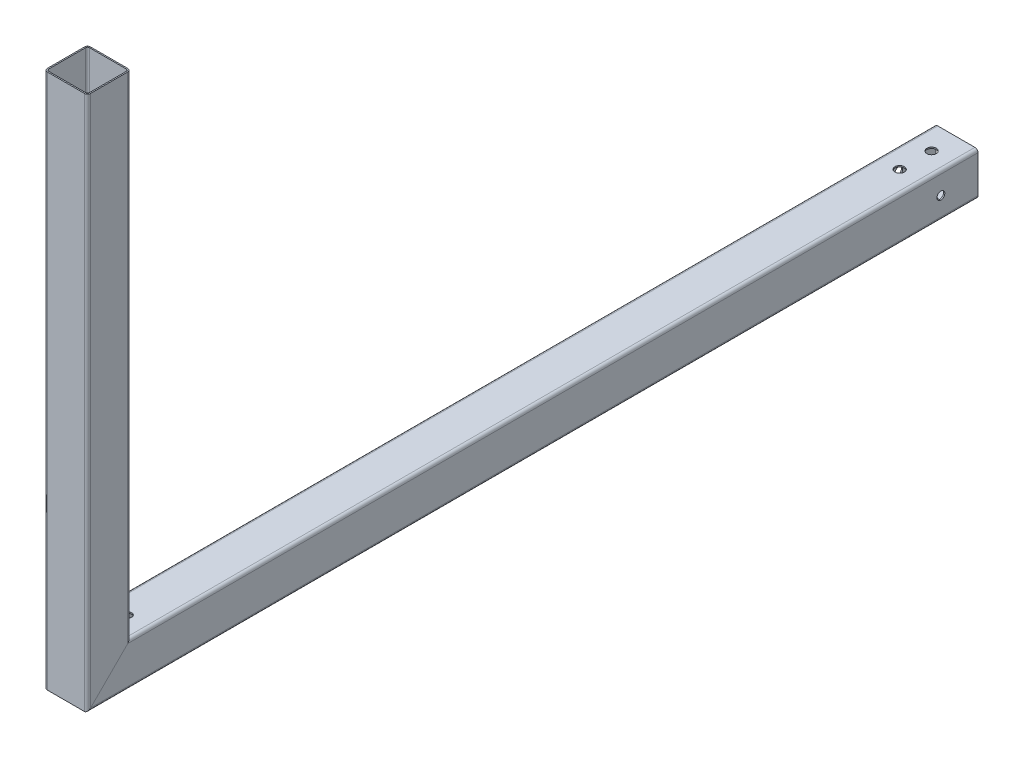
from build123d import *

# Parameters (mm, degrees)
TUBO_CUADRADO_3_X_3_X_0_25_1_DEPTH        = 880.497474683
TUBO_CUADRADO_3_X_3_X_0_25_1_2_DEPTH      = 1403.97
TUBO_CUADRADO_3_X_3_X_0_25_1_2_DEPTH_BACK = 50.497474683
CROQUIS3_R                                = 7.610855116
CROQUIS3_R_2                              = 6.35
CORTAR_EXTRUIR1_DEPTH                     = 1085.618315457
CROQUIS4_R                                = 6.35
CORTAR_EXTRUIR2_DEPTH                     = 867.341093464


with BuildPart() as part:
    # Sketch1 on segment 1 (carried to segment 1) → Tubo cuadrado 3 X 3 X 0.25(1) (new body)
    with BuildSketch(Plane(origin=(0, 415, 701.985), x_dir=(0, 0, -1), z_dir=(0, -1, 0))):
        with BuildLine():
            Line((-30, -35), (30, -35))
            ThreePointArc((30, -35), (33.535533906, -33.535533906), (35, -30))
            Line((35, -30), (35, 30))
            ThreePointArc((35, 30), (33.535533906, 33.535533906), (30, 35))
            Line((30, 35), (-30, 35))
            ThreePointArc((-30, 35), (-33.535533906, 33.535533906), (-35, 30))
            Line((-35, 30), (-35, -30))
            ThreePointArc((-35, -30), (-33.535533906, -33.535533906), (-30, -35))
        make_face()
        with BuildLine():
            Line((-30, -33), (30, -33))
            ThreePointArc((30, -33), (32.121320344, -32.121320344), (33, -30))
            Line((33, -30), (33, 30))
            ThreePointArc((33, 30), (32.121320344, 32.121320344), (30, 33))
            Line((30, 33), (-30, 33))
            ThreePointArc((-30, 33), (-32.121320344, 32.121320344), (-33, 30))
            Line((-33, 30), (-33, -30))
            ThreePointArc((-33, -30), (-32.121320344, -32.121320344), (-30, -33))
        make_face(mode=Mode.SUBTRACT)
    extrude(amount=TUBO_CUADRADO_3_X_3_X_0_25_1_DEPTH)

    # Tubo cuadrado 3 X 3 X 0.25(1) mitre 1
    split(bisect_by=Plane(origin=(0, -415, 701.985), x_dir=(-1, 0, 0), z_dir=(0, 0.707106781, 0.707106781)), keep=Keep.TOP)


with BuildPart() as body_2:
    # Sketch1 → Tubo cuadrado 3 X 3 X 0.25_1 2 (new, two sides: drawn at the far end of the back side and taken through both)
    with BuildSketch(Plane(origin=(0, -415, 701.985), x_dir=(0, 1, 0), z_dir=(0, 0, -1)).offset(-TUBO_CUADRADO_3_X_3_X_0_25_1_2_DEPTH_BACK)):
        with BuildLine():
            Line((-30, -35), (30, -35))
            ThreePointArc((30, -35), (33.535533906, -33.535533906), (35, -30))
            Line((35, -30), (35, 30))
            ThreePointArc((35, 30), (33.535533906, 33.535533906), (30, 35))
            Line((30, 35), (-30, 35))
            ThreePointArc((-30, 35), (-33.535533906, 33.535533906), (-35, 30))
            Line((-35, 30), (-35, -30))
            ThreePointArc((-35, -30), (-33.535533906, -33.535533906), (-30, -35))
        make_face()
        with BuildLine():
            Line((-30, -33), (30, -33))
            ThreePointArc((30, -33), (32.121320344, -32.121320344), (33, -30))
            Line((33, -30), (33, 30))
            ThreePointArc((33, 30), (32.121320344, 32.121320344), (30, 33))
            Line((30, 33), (-30, 33))
            ThreePointArc((-30, 33), (-32.121320344, 32.121320344), (-33, 30))
            Line((-33, 30), (-33, -30))
            ThreePointArc((-33, -30), (-32.121320344, -32.121320344), (-30, -33))
        make_face(mode=Mode.SUBTRACT)
    extrude(amount=TUBO_CUADRADO_3_X_3_X_0_25_1_2_DEPTH + TUBO_CUADRADO_3_X_3_X_0_25_1_2_DEPTH_BACK)

    # Tubo cuadrado 3 X 3 X 0.25_1 2 mitre 1
    split(bisect_by=Plane(origin=(0, -415, 701.985), x_dir=(1, 0, 0), z_dir=(0, -0.707106781, -0.707106781)), keep=Keep.TOP)

    # Croquis3 → Cortar-Extruir1 (cut, through all)
    with BuildSketch(Plane(origin=(0, -380, 0), x_dir=(1, 0, 0), z_dir=(0, 1, 0))):
        with Locations(Location((0, 661.985, 0), (0, 0, 270))):
            Circle(CROQUIS3_R)
        with Locations(Location((0, 610.383182555, 0), (0, 0, 270))):
            Circle(CROQUIS3_R)
        with Locations(Location((0, -636.985, 0), (0, 0, 270))):
            Circle(CROQUIS3_R_2)
    extrude(amount=-CORTAR_EXTRUIR1_DEPTH, mode=Mode.SUBTRACT)

    # Croquis4 → Cortar-Extruir2 (cut, through all)
    with BuildSketch(Plane(origin=(35, 0, 0), x_dir=(0, 0, -1), z_dir=(1, 0, 0))):
        with Locations((641.985, -415)):
            Circle(CROQUIS4_R)
    extrude(amount=-CORTAR_EXTRUIR2_DEPTH, mode=Mode.SUBTRACT)


solid = Compound([part.part, body_2.part])
